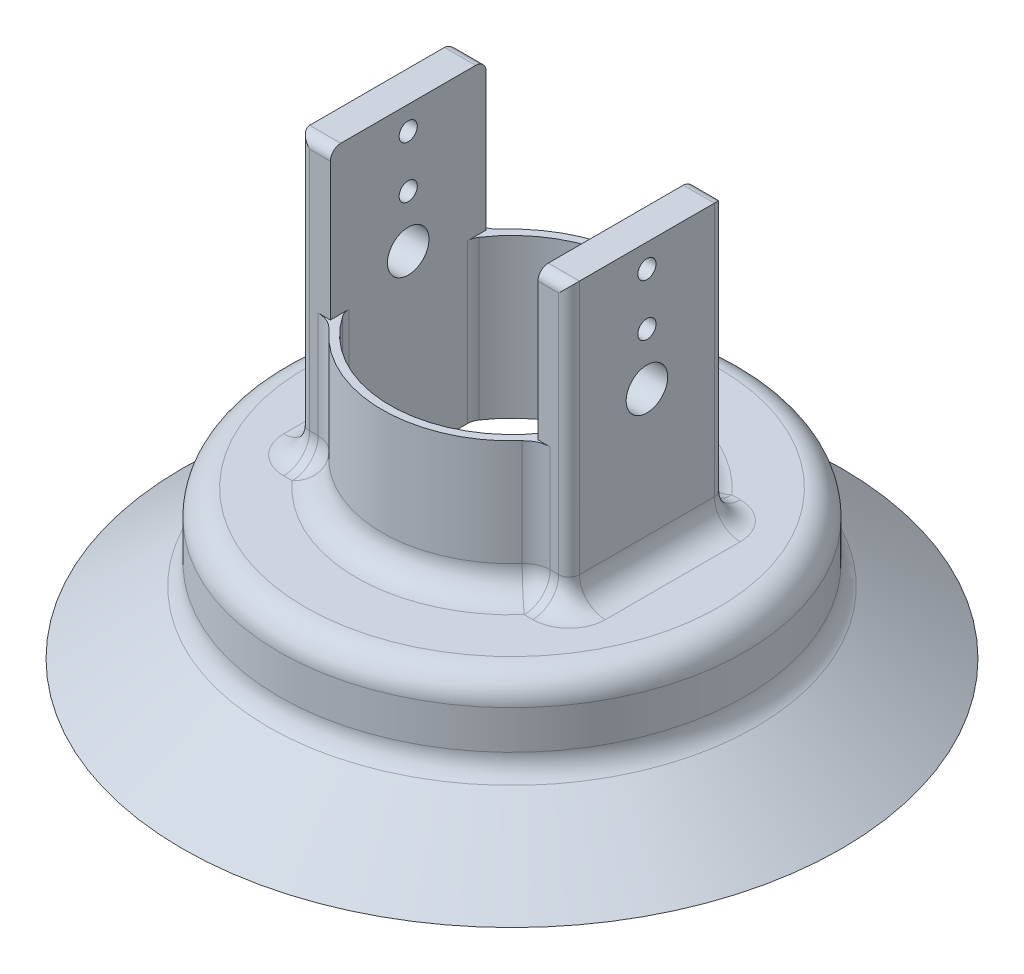
from build123d import *

# Parameters (mm, degrees)
SKETCH_4_R          = 44.85
SKETCH_4_R_2        = 39.75
EXTRUDE_1_DEPTH     = 10
SKETCH_5_R          = 44.85
EXTRUDE_2_DEPTH     = 5
EXTRUDE_3_DEPTH     = 25.5
SKETCH_7_W          = 6
SKETCH_7_H          = 30
EXTRUDE_4_DEPTH     = 28.5
SKETCH_8_R          = 1.75
SKETCH_8_R_2        = 4
CUT_EXTRUDE_1_DEPTH = 138.29074987
FILLET_1_R          = 5
FILLET_2_R          = 2
FILLET_3_R          = 5
FILLET_4_R          = 3
FILLET_5_R          = 3


with BuildPart() as part:
    # 草图3 → 旋转1 (revolve)
    with BuildSketch(Plane(origin=(0, 0, 0), x_dir=(0, 0, -1), z_dir=(1, 0, 0)), mode=Mode.PRIVATE) as revolve_1_sk:
        Polygon((-44.85, 13.5), (-63.5, 0), (-58.5, 0), (-39.75, 13.5), align=None)
    revolve(revolve_1_sk.sketch.rotate(Axis((0, 0, 0), (0, 1, 0)), 180), axis=Axis((0, 0, 0), (0, 1, 0)))

    # 草图4 → 凸台-拉伸1 (add)
    with BuildSketch(Plane(origin=(0, 13.5, 0), x_dir=(1, 0, 0), z_dir=(0, 1, 0))):
        with Locations(Location((0, 0, 0), (0, 0, 270))):
            Circle(SKETCH_4_R)
        with Locations(Location((0, 0, 0), (0, 0, 90))):
            Circle(SKETCH_4_R_2, mode=Mode.SUBTRACT)
    extrude(amount=EXTRUDE_1_DEPTH)

    # 草图5 → 凸台-拉伸2 (add)
    with BuildSketch(Plane(origin=(0, 23.5, 0), x_dir=(1, 0, 0), z_dir=(0, 1, 0))):
        with Locations(Location((0, 0, 0), (0, 0, 270))):
            Circle(SKETCH_5_R)
        with BuildLine():
            Line((-20, 12.338962679), (-20, -12.338962679))
            ThreePointArc((-20, -12.338962679), (0, -23.5), (20, -12.338962679))
            Line((20, -12.338962679), (20, 12.338962679))
            ThreePointArc((20, 12.338962679), (0, 23.5), (-20, 12.338962679))
        make_face(mode=Mode.SUBTRACT)
    extrude(amount=EXTRUDE_2_DEPTH)

    # 草图6 → 凸台-拉伸3 (add)
    with BuildSketch(Plane(origin=(0, 28.5, 0), x_dir=(1, 0, 0), z_dir=(0, 1, 0))):
        with BuildLine():
            Line((-26, -15), (-20, -15))
            ThreePointArc((-20, -15), (0, -25), (20, -15))
            Line((20, -15), (26, -15))
            Line((26, -15), (26, 15))
            Line((26, 15), (20, 15))
            ThreePointArc((20, 15), (0, 25), (-20, 15))
            Line((-20, 15), (-26, 15))
            Line((-26, 15), (-26, -15))
        make_face()
        with BuildLine():
            Line((20, -12.338962679), (20, 12.338962679))
            ThreePointArc((20, 12.338962679), (0, 23.5), (-20, 12.338962679))
            Line((-20, 12.338962679), (-20, -12.338962679))
            ThreePointArc((-20, -12.338962679), (0, -23.5), (20, -12.338962679))
        make_face(mode=Mode.SUBTRACT)
    extrude(amount=EXTRUDE_3_DEPTH)

    # 草图7 → 凸台-拉伸4 (add)
    with BuildSketch(Plane(origin=(0, 54, 0), x_dir=(1, 0, 0), z_dir=(0, 1, 0))):
        with Locations((-23, 0)):
            Rectangle(SKETCH_7_W, SKETCH_7_H)
        with Locations((23, 0)):
            Rectangle(SKETCH_7_W, SKETCH_7_H)
    extrude(amount=EXTRUDE_4_DEPTH)

    # 草图8 → 切除-拉伸1 (cut, through all)
    with BuildSketch(Plane.ZY.offset(26)):
        with Locations((0, 78)):
            Circle(SKETCH_8_R)
        with Locations((0, 68)):
            Circle(SKETCH_8_R)
        with Locations((0, 58)):
            Circle(SKETCH_8_R_2)
    extrude(amount=-CUT_EXTRUDE_1_DEPTH, mode=Mode.SUBTRACT)

    # 圆角1
    fillet_1_edges = [part.edges().sort_by_distance(p)[0] for p in [
        (-20, 41.25, 15),
        (20, 41.25, 15),
        (20, 41.25, -15),
        (-20, 41.25, -15),
    ]]
    fillet(fillet_1_edges, radius=FILLET_1_R)

    # 圆角2
    fillet_2_edges = [part.edges().sort_by_distance(p)[0] for p in [
        (26, 55.5, 15),
        (26, 55.5, -15),
        (-26, 55.5, -15),
        (-26, 55.5, 15),
        (-23, 82.5, 15),
        (-23, 82.5, -15),
        (23, 82.5, -15),
        (23, 82.5, 15),
    ]]
    fillet(fillet_2_edges, radius=FILLET_2_R)

    # 圆角3
    fillet_3_edges = [part.edges().sort_by_distance(p)[0] for p in [
        (44.85, 13.5, 0),
        (0, 28.5, 25),
        (0, 28.5, -25),
        (-20.319438323, 28.5, -15.435645354),
        (20.319438323, 28.5, -15.435645354),
        (-20.319438323, 28.5, 15.435645354),
        (20.319438323, 28.5, 15.435645354),
        (-23.180339887, 28.5, 15),
        (-23.180339887, 28.5, -15),
        (0, 28.5, -44.85),
        (23.180339887, 28.5, 15),
        (23.180339887, 28.5, -15),
        (-26, 28.5, 0),
        (26, 28.5, 0),
        (-25.414213562, 28.5, -14.414213562),
        (25.414213562, 28.5, -14.414213562),
        (-25.414213562, 28.5, 14.414213562),
        (25.414213562, 28.5, 14.414213562),
    ]]
    fillet(fillet_3_edges, radius=FILLET_3_R)

    # 圆角4
    fillet_4_edges = [part.edges().sort_by_distance(p)[0] for p in [
        (0, 23.5, 39.75),
        (-20, 38.75, -12.338962679),
        (-20, 38.75, 12.338962679),
        (20, 38.75, 12.338962679),
        (20, 38.75, -12.338962679),
        (0, 13.5, 39.75),
    ]]
    fillet(fillet_4_edges, radius=FILLET_4_R)

    # 圆角5
    fillet_5_edges = [part.edges().sort_by_distance(p)[0] for p in [
        (0, 0, 58.5),
    ]]
    fillet(fillet_5_edges, radius=FILLET_5_R)


solid = part.part
